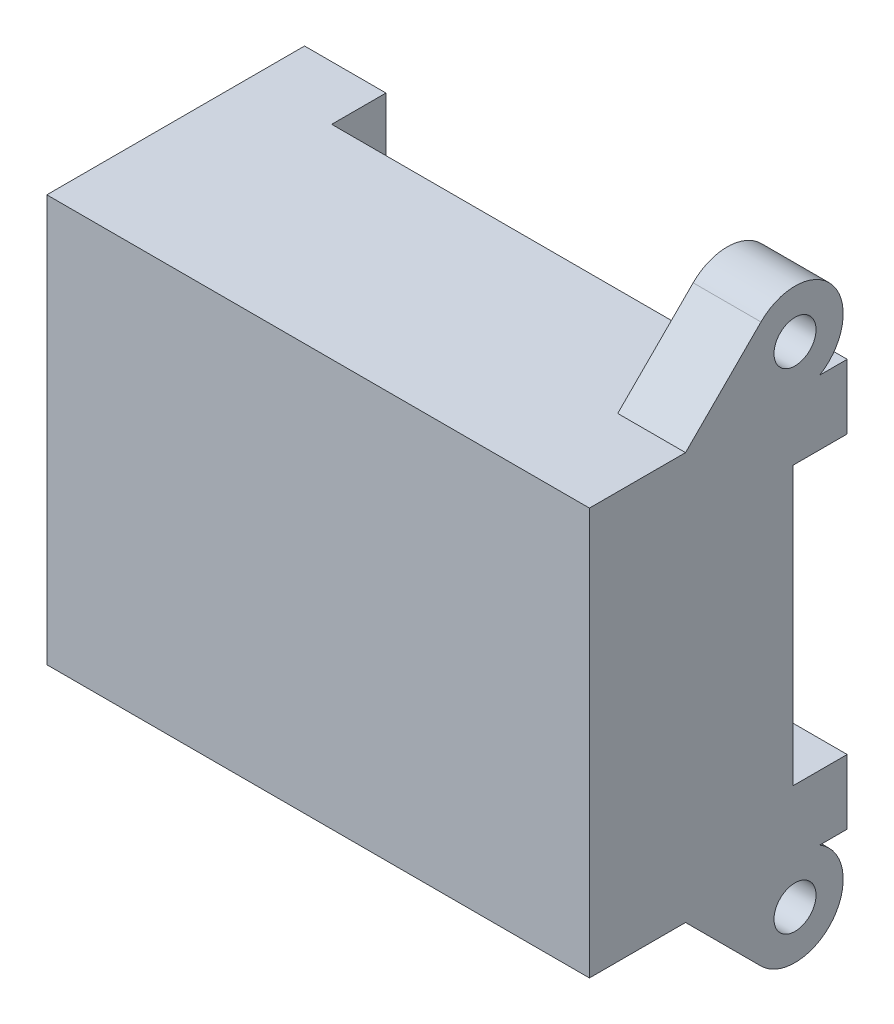
from build123d import *

# Parameters (mm, degrees)
SKETCH_1_W      = 40
SKETCH_1_H      = 30
EXTRUDE_1_DEPTH = 15
SKETCH_3_R      = 1.55
EXTRUDE_2_DEPTH = 5
SKETCH_4_W      = 6
SKETCH_4_H      = 4.77
EXTRUDE_3_DEPTH = 4


with BuildPart() as part:
    # 草图1 → 凸台-拉伸1 (new body)
    with BuildSketch(Plane.XY):
        with Locations((-64.15, 0.5)):
            Rectangle(SKETCH_1_W, SKETCH_1_H)
    extrude(amount=-EXTRUDE_1_DEPTH)

    # 草图3 → 凸台-拉伸2 (add)
    with BuildSketch(Plane(origin=(-44.15, 0, 0), x_dir=(0, 0, -1), z_dir=(1, 0, 0))):
        with BuildLine():
            Line((7.084541854, 15.5), (15, 15.5))
            Line((15, 15.5), (15, 15.003385417))
            ThreePointArc((15, 15.003385417), (18.463655357, 19.83658452), (12.644770927, 21.060229073))
            Line((12.644770927, 21.060229073), (7.084541854, 15.5))
        make_face()
        with Locations((15.155, 18.55)):
            Circle(SKETCH_3_R, mode=Mode.SUBTRACT)
    extrude_2 = extrude(amount=-EXTRUDE_2_DEPTH)

    # 镜向2: 凸台-拉伸2 across plane
    add(extrude_2.mirror(Plane.ZX.offset(0.5)))

    # 草图4 → 凸台-拉伸3 (add)
    with BuildSketch(Plane(origin=(0, 0, -15), x_dir=(-1, 0, 0), z_dir=(0, 0, -1))):
        with Locations((47.15, 13.115)):
            Rectangle(SKETCH_4_W, SKETCH_4_H)
        with Locations((81.15, 13.115)):
            Rectangle(SKETCH_4_W, SKETCH_4_H)
        with Locations((81.15, -12.115)):
            Rectangle(SKETCH_4_W, SKETCH_4_H)
        with Locations((47.15, -12.115)):
            Rectangle(SKETCH_4_W, SKETCH_4_H)
    extrude(amount=EXTRUDE_3_DEPTH)


solid = part.part
